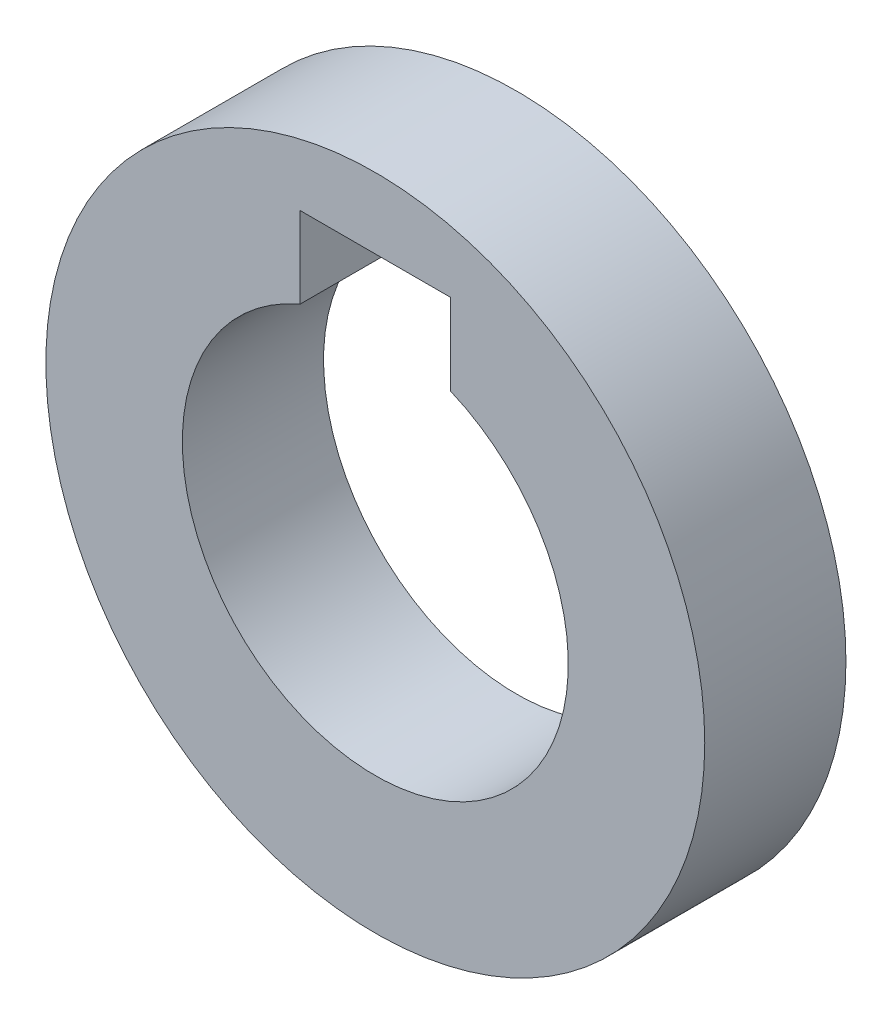
from build123d import *

# Parameters (mm, degrees)
SKETCH1_R           = 7
BOSS_EXTRUDE1_DEPTH = 3


with BuildPart() as part:
    # Sketch1 → Boss-Extrude1 (new body)
    with BuildSketch(Plane.XY):
        Circle(SKETCH1_R)
        with BuildLine():
            Line((-1.6, 3.774917218), (-1.6, 5.5))
            Line((-1.6, 5.5), (1.6, 5.5))
            Line((1.6, 5.5), (1.6, 3.774917218))
            ThreePointArc((1.6, 3.774917218), (0, -4.1), (-1.6, 3.774917218))
        make_face(mode=Mode.SUBTRACT)
    extrude(amount=BOSS_EXTRUDE1_DEPTH)


solid = part.part
